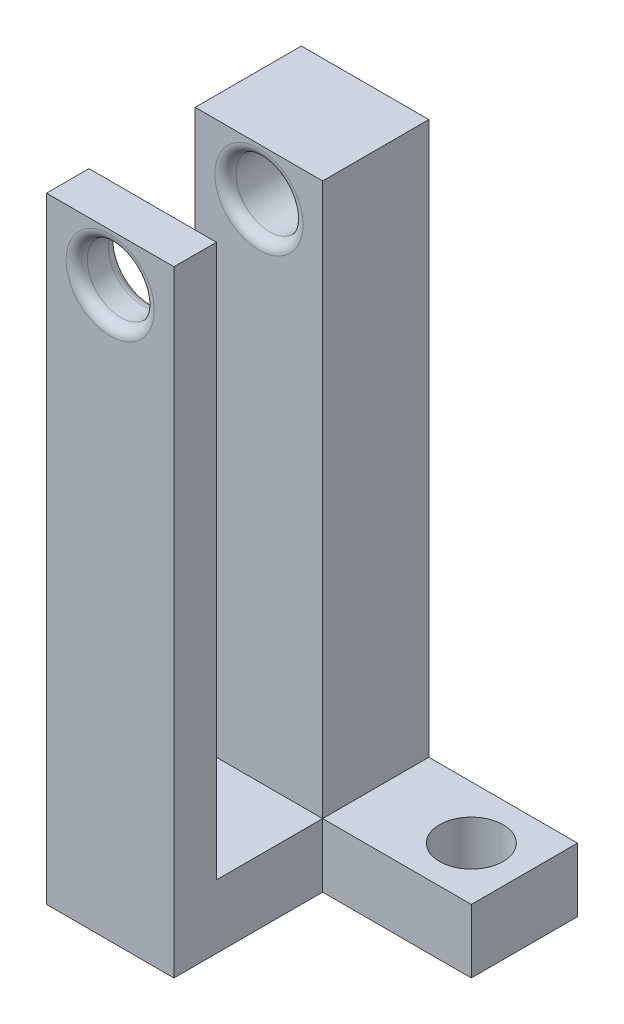
from build123d import *

# Parameters (mm, degrees)
SKETCH1_R           = 1.5
BOSS_EXTRUDE1_DEPTH = 3
SKETCH2_W           = 6
SKETCH2_H           = 5
SKETCH2_H_2         = 2
BOSS_EXTRUDE2_DEPTH = 26
CUT_EXTRUDE1_REACH  = 34.939
SKETCH3_R           = 1.575
FILLET1_R           = 0.5


with BuildPart() as part:
    # Sketch1 → Boss-Extrude1 (new body)
    with BuildSketch(Plane(origin=(0, 0, 0), x_dir=(1, 0, 0), z_dir=(0, 1, 0))):
        Polygon((-10, 4.075667656), (10, 4.075667656), (10, -0.924332344), (3, -0.924332344), (3, -7.924332344), (-3, -7.924332344), (-3, -0.924332344), (-10, -0.924332344), align=None)
        with Locations(Location((7.5, 1.575667656, 0), (0, 0, 270))):
            Circle(SKETCH1_R, mode=Mode.SUBTRACT)
        with Locations(Location((-7.5, 1.575667656, 0), (0, 0, 270))):
            Circle(SKETCH1_R, mode=Mode.SUBTRACT)
    extrude(amount=BOSS_EXTRUDE1_DEPTH)

    # Sketch2 → Boss-Extrude2 (add)
    with BuildSketch(Plane(origin=(0, 3, 0), x_dir=(1, 0, 0), z_dir=(0, 1, 0))):
        with Locations((0, 1.575667656)):
            Rectangle(SKETCH2_W, SKETCH2_H)
        with Locations((0, -6.924332344)):
            Rectangle(SKETCH2_W, SKETCH2_H_2)
    extrude(amount=BOSS_EXTRUDE2_DEPTH)

    # Cut-Extrude1: up to this face of the body (flat: up to its plane)
    cut_extrude1_end = Plane(part.part.faces().sort_by_distance((0, 14.5, 7.924332344))[0])
    # Sketch3 → Cut-Extrude1 (cut, up to the picked face)
    with BuildSketch(Plane(origin=(0, 0, -4.075667656), x_dir=(-1, 0, 0), z_dir=(0, 0, -1)), mode=Mode.PRIVATE) as cut_extrude1_sk1:
        with Locations((0, 26.75)):
            Circle(SKETCH3_R)
    cut_extrude1_tool1 = split(extrude(cut_extrude1_sk1.sketch, amount=-CUT_EXTRUDE1_REACH, mode=Mode.PRIVATE), bisect_by=cut_extrude1_end, keep=Keep.BOTH, mode=Mode.PRIVATE)
    add(cut_extrude1_tool1.solids().sort_by(Axis((0, 26.75, -4.075668), (0, 0, 1)))[0], mode=Mode.SUBTRACT)

    # Fillet1
    fillet1_edges = [part.edges().sort_by_distance(p)[0] for p in [
        (1.575, 26.75, 0.924332344),
        (1.575, 26.75, 5.924332344),
        (1.575, 26.75, -4.075667656),
        (1.575, 26.75, 7.924332344),
    ]]
    fillet(fillet1_edges, radius=FILLET1_R)


solid = part.part
